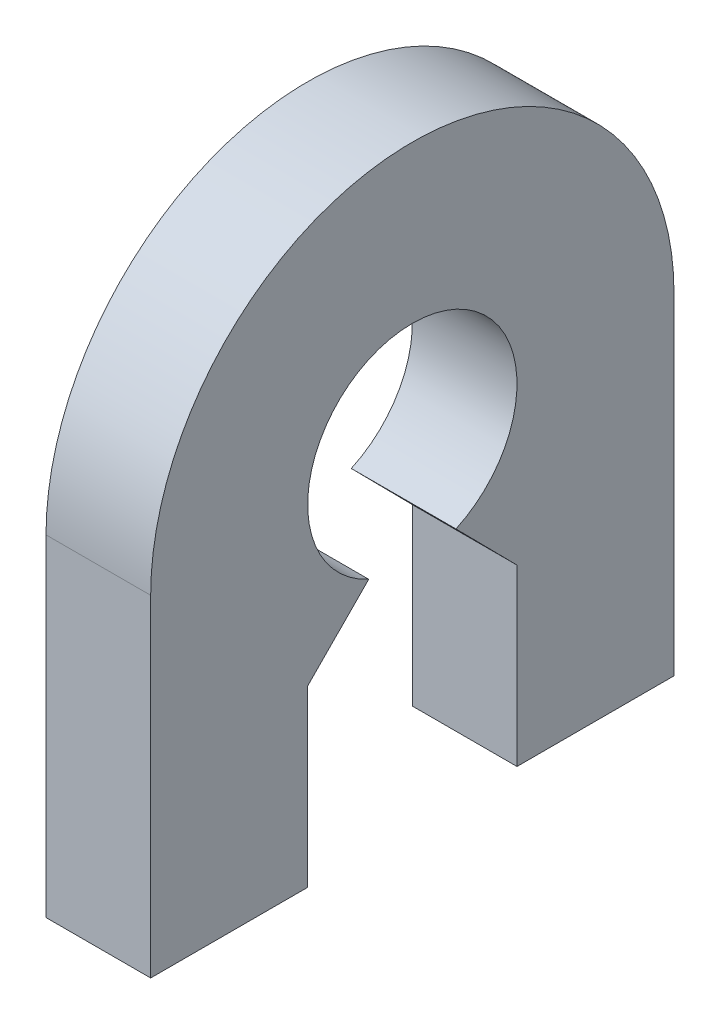
from build123d import *

# Parameters (mm, degrees)
EXTRUDE_1_DEPTH = 3


with BuildPart() as part:
    # Эскиз2 → Бобышка-Вытянуть1 (new, symmetric)
    with BuildSketch(Plane(origin=(0, 0, 0), x_dir=(0, 0, -1), z_dir=(1, 0, 0))):
        with BuildLine():
            Line((15, 5), (6, 5))
            Line((6, 5), (6, 15))
            Line((6, 15), (2.5, 18.545643943))
            ThreePointArc((2.5, 18.545643943), (0, 30), (-2.5, 18.545643943))
            Line((-2.5, 18.545643943), (-6, 15))
            Line((-6, 15), (-6, 5))
            Line((-6, 5), (-15, 5))
            Line((-15, 5), (-15, 24))
            ThreePointArc((-15, 24), (0, 39), (15, 24))
            Line((15, 24), (15, 5))
        make_face()
    extrude(amount=EXTRUDE_1_DEPTH, both=True)


solid = part.part
